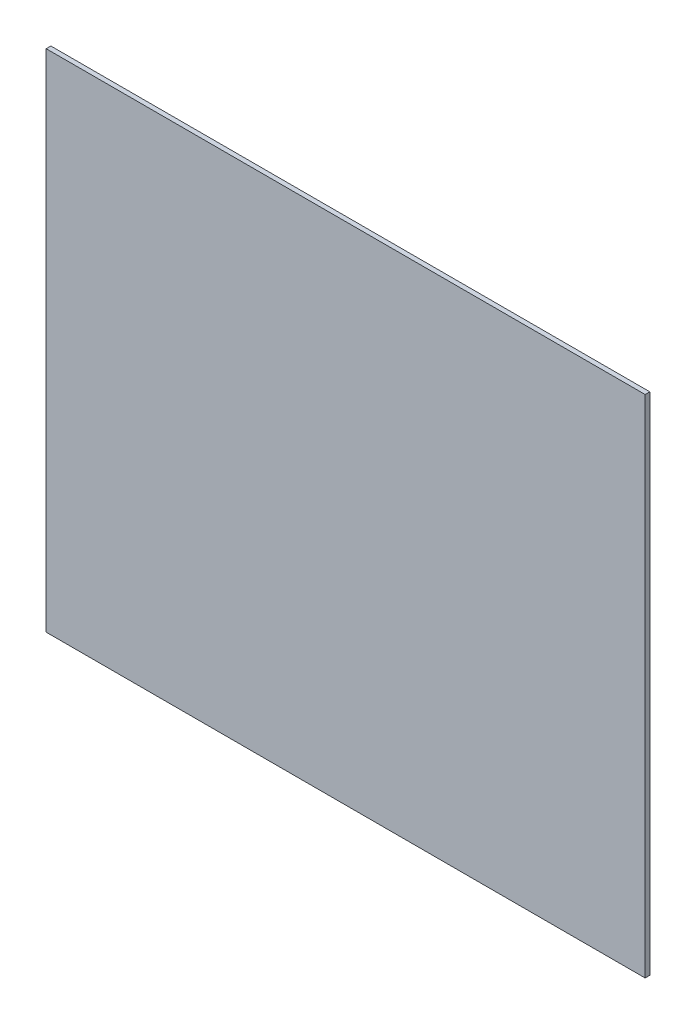
from build123d import *

# Parameters (mm, degrees)
ESQUISSE1_W        = 832
ESQUISSE1_H        = 702
BOSS_EXTRU_1_DEPTH = 6.5


with BuildPart() as part:
    # Esquisse1 → Boss.-Extru.1 (new body)
    with BuildSketch(Plane.XY):
        Rectangle(ESQUISSE1_W, ESQUISSE1_H)
    extrude(amount=BOSS_EXTRU_1_DEPTH)


solid = part.part
